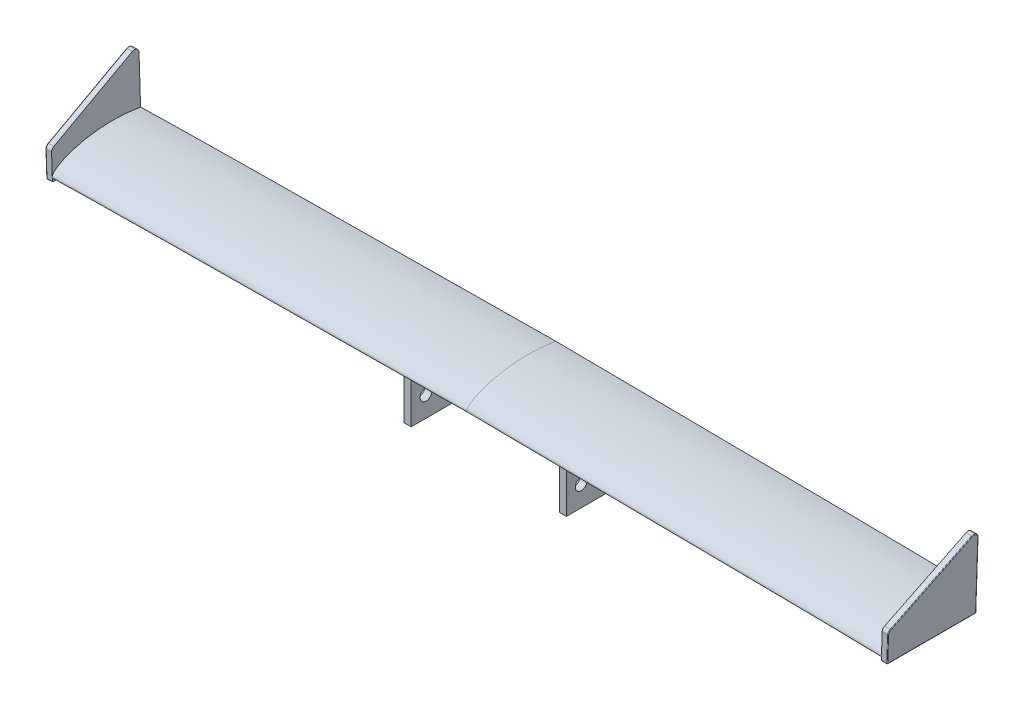
from build123d import *

# Parameters (mm, degrees)
BOSS_EXTRUDE1_DEPTH             = 20
FILLET1_R                       = 15
FILLET2_R                       = 2
BOSS_EXTRUDE2_REACH             = 1476.182
SKETCH8_W                       = 24
SKETCH8_H                       = 180
BOSS_EXTRUDE2_DIRECTION_2_DEPTH = 200
CUT_EXTRUDE1_REACH              = 1212.776
SKETCH9_R                       = 20
LPATTERN1_COUNT                 = 2
LPATTERN1_PITCH                 = 90
LPATTERN1_COUNT_DIR2            = 2
LPATTERN1_PITCH_DIR2            = 90
MIRROR1_COPY_1_REACH            = 1212.776
MIRROR1_COPY_1_SKETCH_R         = 20
MIRROR1_COPY_2_REACH            = 1212.776
MIRROR1_COPY_2_SKETCH_R         = 20
MIRROR1_COPY_3_REACH            = 1212.776
MIRROR1_COPY_3_SKETCH_R         = 20
FILLET1_OF_MIRROR1_R            = 15
FILLET2_OF_MIRROR1_R            = 2


with BuildPart() as part:
    # Sweep1: sweep along a path in Sketch2
    with BuildLine() as sweep1_path:  # in the path sketch's own coordinates; laid on its plane below (add() does not lay a ready-made edge on the line's plane)
        add(Edge.make_bspline(
            [(0, 0), (1291.911018877, -11.527399936), (1399.896197675, -16.150476282)],
            knots=[0, 0, 0, 1, 1, 1], degree=2))
    # Sketch1 → Sweep1 (sweep)
    with BuildSketch(Plane(origin=(0, 0, 0), x_dir=(0, 0, -1), z_dir=(1, 0, 0))):
        with BuildLine():
            add(Edge.make_bspline(
                [(0, 0), (-7.6862496, 24.227483369), (121.292223463, 86.485897887), (300, 56.434218629)],
                knots=[0, 0, 0, 0, 1, 1, 1, 1], degree=3))
            add(Edge.make_bspline(
                [(0, 0), (64.659318744, -8.929352198), (300, 56.434218629)],
                knots=[0, 0, 0, 1, 1, 1], degree=2))
        make_face()
    sweep1 = sweep(path=Plane.XY * sweep1_path.line)

    # Sketch7 → Boss-Extrude1 (add)
    with BuildSketch(Plane(origin=(1398.837992904, -47.387659952, 0), x_dir=(0, 0, -1), z_dir=(0.99942668660733, -0.0338570243390299, 0))):
        Polygon((0, 18.954975692), (0, 114.157124207), (300, 269.951405066), (300, 18.954975692), align=None)
    boss_extrude1 = extrude(amount=BOSS_EXTRUDE1_DEPTH)

    # Fillet1
    fillet1_edges = [part.edges().sort_by_distance(p)[0] for p in [
        (1417.972011062, 222.070408114, -300),
        (1412.697280303, 66.365446203, 0),
    ]]
    fillet(fillet1_edges, radius=FILLET1_R)

    # Fillet2
    fillet2_edges = [part.edges().sort_by_distance(p)[0] for p in [
        (1409.474018844, -28.782121645, 0),
        (1409.474018844, -28.782121645, -300),
        (1419.46828571, -29.120691888, -150),
        (1423.299286815, 83.966763846, -300),
        (1425.207363331, 140.291341308, -143.08689544),
        (1420.925657974, 13.899530985, 0),
        (1422.646706073, 64.703210087, -2.180160524),
        (1427.564329538, 209.86670927, -292.787921147),
    ]]
    fillet(fillet2_edges, radius=FILLET2_R)

    # Sketch8 → Boss-Extrude2 (add, up to next)
    with BuildSketch(Plane(origin=(0, 0, 0), x_dir=(1, 0, 0), z_dir=(0, 1, 0)), mode=Mode.PRIVATE) as boss_extrude2_sk1:
        with Locations((262, 152)):
            Rectangle(SKETCH8_W, SKETCH8_H)
    boss_extrude2_tool1 = extrude(boss_extrude2_sk1.sketch, amount=BOSS_EXTRUDE2_REACH, mode=Mode.PRIVATE) - part.part
    boss_extrude2 = boss_extrude2_tool1.solids().sort_by_distance((262, 0, -152))[0]
    add(boss_extrude2)

    # Sketch8 → Boss-Extrude2 direction 2 (add)
    with BuildSketch(Plane(origin=(0, 0, 0), x_dir=(1, 0, 0), z_dir=(0, 1, 0))):
        with Locations((262, 152)):
            Rectangle(SKETCH8_W, SKETCH8_H)
    boss_extrude2_direction_2 = extrude(amount=-BOSS_EXTRUDE2_DIRECTION_2_DEPTH)

    # Sketch9 → Cut-Extrude1 (cut, up to next)
    with BuildSketch(Plane(origin=(274, 0, 0), x_dir=(0, 0, -1), z_dir=(1, 0, 0)), mode=Mode.PRIVATE) as cut_extrude1_sk1:
        with Locations((202, -40)):
            Circle(SKETCH9_R)
    cut_extrude1_tool1 = extrude(cut_extrude1_sk1.sketch, amount=-CUT_EXTRUDE1_REACH, mode=Mode.PRIVATE) & part.part
    cut_extrude1 = cut_extrude1_tool1.solids().sort_by_distance((274, -40, -202))[0]
    add(cut_extrude1, mode=Mode.SUBTRACT)

    # LPattern1: Cut-Extrude1 2 × 2
    with Locations(*[(0, -i * LPATTERN1_PITCH, j * LPATTERN1_PITCH_DIR2) for i in range(LPATTERN1_COUNT) for j in range(LPATTERN1_COUNT_DIR2) if (i, j) != (0, 0)]):
        add(cut_extrude1, mode=Mode.SUBTRACT)

    # Mirror1: Sweep1, Boss-Extrude1, Boss-Extrude2, Boss-Extrude2 direction 2, Cut-Extrude1 across plane
    add(sweep1.mirror(Plane(origin=(0, 0, 0), x_dir=(0, 0, 1), z_dir=(1, 0, 0))))
    add(boss_extrude1.mirror(Plane(origin=(0, 0, 0), x_dir=(0, 0, 1), z_dir=(1, 0, 0))))
    add(boss_extrude2.mirror(Plane(origin=(0, 0, 0), x_dir=(0, 0, 1), z_dir=(1, 0, 0))))
    add(boss_extrude2_direction_2.mirror(Plane(origin=(0, 0, 0), x_dir=(0, 0, 1), z_dir=(1, 0, 0))))
    add(cut_extrude1.mirror(Plane(origin=(0, 0, 0), x_dir=(0, 0, 1), z_dir=(1, 0, 0))), mode=Mode.SUBTRACT)

    # Mirror1 copy 1 sketch → Mirror1 copy 1 (cut, up to next)
    with BuildSketch(Plane(origin=(-274, 0, 90), x_dir=(0, 0, -1), z_dir=(-1, 0, 0)), mode=Mode.PRIVATE) as mirror1_copy_1_sk1:
        with Locations((202, 40)):
            Circle(MIRROR1_COPY_1_SKETCH_R)
    mirror1_copy_1_tool1 = extrude(mirror1_copy_1_sk1.sketch, amount=-MIRROR1_COPY_1_REACH, mode=Mode.PRIVATE) & part.part
    add(mirror1_copy_1_tool1.solids().sort_by_distance((-274, -40, -112))[0], mode=Mode.SUBTRACT)

    # Mirror1 copy 2 sketch → Mirror1 copy 2 (cut, up to next)
    with BuildSketch(Plane(origin=(-274, -90, 0), x_dir=(0, 0, -1), z_dir=(-1, 0, 0)), mode=Mode.PRIVATE) as mirror1_copy_2_sk1:
        with Locations((202, 40)):
            Circle(MIRROR1_COPY_2_SKETCH_R)
    mirror1_copy_2_tool1 = extrude(mirror1_copy_2_sk1.sketch, amount=-MIRROR1_COPY_2_REACH, mode=Mode.PRIVATE) & part.part
    add(mirror1_copy_2_tool1.solids().sort_by_distance((-274, -130, -202))[0], mode=Mode.SUBTRACT)

    # Mirror1 copy 3 sketch → Mirror1 copy 3 (cut, up to next)
    with BuildSketch(Plane(origin=(-274, -90, 90), x_dir=(0, 0, -1), z_dir=(-1, 0, 0)), mode=Mode.PRIVATE) as mirror1_copy_3_sk1:
        with Locations((202, 40)):
            Circle(MIRROR1_COPY_3_SKETCH_R)
    mirror1_copy_3_tool1 = extrude(mirror1_copy_3_sk1.sketch, amount=-MIRROR1_COPY_3_REACH, mode=Mode.PRIVATE) & part.part
    add(mirror1_copy_3_tool1.solids().sort_by_distance((-274, -130, -112))[0], mode=Mode.SUBTRACT)

    # Fillet1 of Mirror1
    fillet1_of_mirror1_edges = [part.edges().sort_by_distance(p)[0] for p in [
        (-1417.972011062, 222.070408114, -300),
        (-1412.697280303, 66.365446203, 0),
    ]]
    fillet(fillet1_of_mirror1_edges, radius=FILLET1_OF_MIRROR1_R)

    # Fillet2 of Mirror1
    fillet2_of_mirror1_edges = [part.edges().sort_by_distance(p)[0] for p in [
        (-1409.474018844, -28.782121645, 0),
        (-1409.474018844, -28.782121645, -300),
        (-1419.46828571, -29.120691888, -150),
        (-1423.299286815, 83.966763846, -300),
        (-1425.207363331, 140.291341308, -143.08689544),
        (-1420.925657974, 13.899530985, 0),
        (-1422.646706073, 64.703210087, -2.180160524),
        (-1427.564329538, 209.86670927, -292.787921147),
    ]]
    fillet(fillet2_of_mirror1_edges, radius=FILLET2_OF_MIRROR1_R)


solid = part.part
